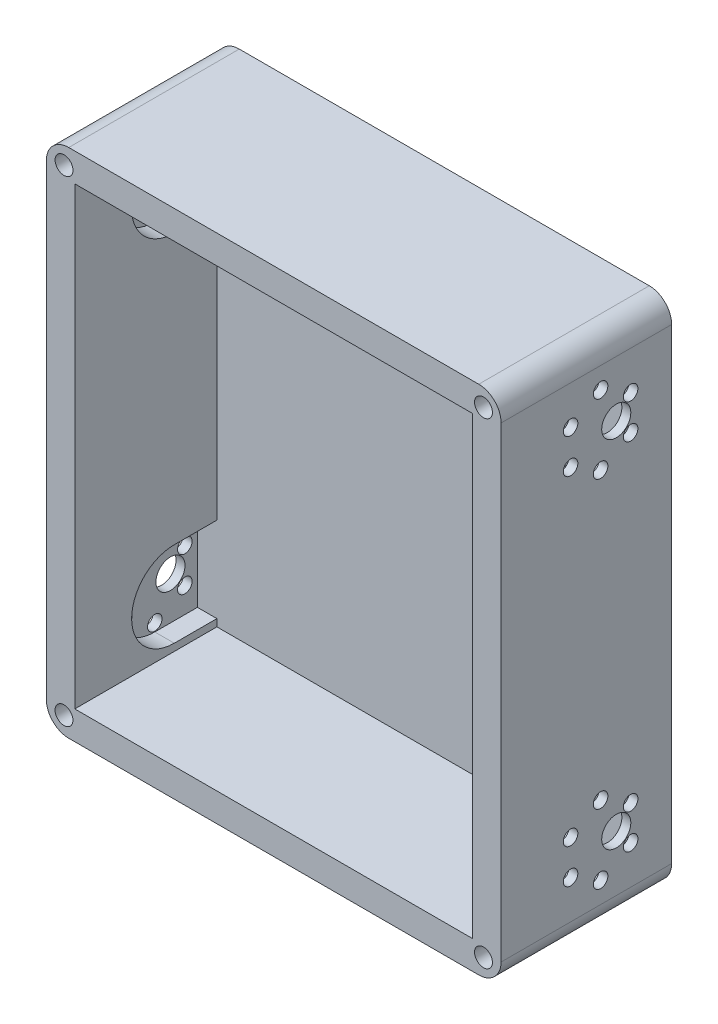
from build123d import *

# Parameters (mm, degrees)
SKETCH1_W                        = 203.2
SKETCH1_H                        = 228.6
CHASSIS_DEPTH                    = 76.2
CHASSIS_COMPARTMENT_T            = -12.7
OUTER_FILLETS_R                  = 10
LEFT_MOTOR_COMPARTMENTS_DEPTH    = 8.7
RIGHT_START                      = -8.7
RIGHT_MOTOR_COMPARTMENTS_DEPTH   = 8.7
SKETCH8_R                        = 3.999993352
SKETCH8_R_2                      = 4
LID_HOLES_DEPTH                  = 10
SCREW_AND_SHAFT_HOLES_DEPTH      = 278.790948922
SCREW_AND_SHAFT_HOLES_DEPTH_BACK = 278.790948922
SKETCH10_R                       = 3.25
SKETCH10_R_2                     = 6.5


with BuildPart() as part:
    # Sketch1 → Chassis (new body)
    with BuildSketch(Plane.XY):
        with Locations((-5.130884808, -63.69081803)):
            Rectangle(SKETCH1_W, SKETCH1_H)
    extrude(amount=CHASSIS_DEPTH)

    # Chassis Compartment
    chassis_compartment_openings = [part.faces().sort_by_distance(p)[0] for p in [
        (-5.130884808, -63.69081803, 76.2),
    ]]
    offset(amount=CHASSIS_COMPARTMENT_T, openings=chassis_compartment_openings, kind=Kind.INTERSECTION)

    # Outer Fillets
    outer_fillets_edges = [part.edges().sort_by_distance(p)[0] for p in [
        (96.469115192, 50.60918197, 38.1),
        (-106.730884808, 50.60918197, 38.1),
        (-106.730884808, -177.99081803, 38.1),
        (96.469115192, -177.99081803, 38.1),
    ]]
    fillet(outer_fillets_edges, radius=OUTER_FILLETS_R)

    # Sketch3 → Left Motor Compartments (cut)
    with BuildSketch(Plane.ZY.offset(94.030884808)):
        with BuildLine():
            Line((31.75, -162.09081803), (12.7, -162.09081803))
            Line((12.7, -162.09081803), (12.7, -123.99081803))
            Line((12.7, -123.99081803), (31.75, -123.99081803))
            ThreePointArc((31.75, -123.99081803), (50.8, -143.04081803), (31.75, -162.09081803))
        make_face()
        with BuildLine():
            Line((31.75, -3.39081803), (12.7, -3.39081803))
            Line((12.7, -3.39081803), (12.7, 34.70918197))
            Line((12.7, 34.70918197), (31.75, 34.70918197))
            ThreePointArc((31.75, 34.70918197), (50.8, 15.65918197), (31.75, -3.39081803))
        make_face()
    extrude(amount=LEFT_MOTOR_COMPARTMENTS_DEPTH, mode=Mode.SUBTRACT)

    # Sketch5 → Right Motor Compartments (cut)
    with BuildSketch(Plane.ZY.offset(-83.769115192).offset(RIGHT_START)):
        with BuildLine():
            Line((31.75, 34.70918197), (12.7, 34.70918197))
            Line((12.7, 34.70918197), (12.7, -3.39081803))
            Line((12.7, -3.39081803), (31.75, -3.39081803))
            ThreePointArc((31.75, -3.39081803), (50.8, 15.65918197), (31.75, 34.70918197))
        make_face()
        with BuildLine():
            Line((31.75, -123.99081803), (12.7, -123.99081803))
            Line((12.7, -123.99081803), (12.7, -162.09081803))
            Line((12.7, -162.09081803), (31.75, -162.09081803))
            ThreePointArc((31.75, -162.09081803), (50.8, -143.04081803), (31.75, -123.99081803))
        make_face()
    extrude(amount=RIGHT_MOTOR_COMPARTMENTS_DEPTH, mode=Mode.SUBTRACT)

    # Sketch8 → Lid Holes (cut)
    with BuildSketch(Plane.XY.offset(76.2)):
        with Locations((88.590435536, -170.112138374)):
            Circle(SKETCH8_R)
        with Locations((-98.852205152, -170.112138374)):
            Circle(SKETCH8_R)
        with Locations((88.590435536, 42.730502314)):
            Circle(SKETCH8_R_2)
        with Locations((-98.836735073, 42.746020894)):
            Circle(SKETCH8_R)
    extrude(amount=-LID_HOLES_DEPTH, mode=Mode.SUBTRACT)

    # Sketch10 → Screw and Shaft Holes (cut, two sides: drawn at the far end of the back side and taken through both)
    with BuildSketch(Plane(origin=(-102.730884808, 0, 0), x_dir=(0, 0, -1), z_dir=(1, 0, 0)).offset(-SCREW_AND_SHAFT_HOLES_DEPTH_BACK)):
        with Locations((-31.75, -127.54081803)):
            Circle(SKETCH10_R)
        with Locations((-45.173393759, -135.29081803)):
            Circle(SKETCH10_R)
        with Locations((-18.326606241, -135.29081803)):
            Circle(SKETCH10_R)
        with Locations((-45.173393759, -150.79081803)):
            Circle(SKETCH10_R)
        with Locations((-18.326606241, -150.79081803)):
            Circle(SKETCH10_R)
        with Locations((-31.75, -158.54081803)):
            Circle(SKETCH10_R)
        with Locations((-31.75, 31.15918197)):
            Circle(SKETCH10_R)
        with Locations((-45.173393759, 23.40918197)):
            Circle(SKETCH10_R)
        with Locations((-18.326606241, 23.40918197)):
            Circle(SKETCH10_R)
        with Locations((-45.173393759, 7.90918197)):
            Circle(SKETCH10_R)
        with Locations((-18.326606241, 7.90918197)):
            Circle(SKETCH10_R)
        with Locations((-31.75, 0.15918197)):
            Circle(SKETCH10_R)
        with Locations((-24.75, -143.04081803)):
            Circle(SKETCH10_R_2)
        with Locations((-24.75, 15.65918197)):
            Circle(SKETCH10_R_2)
    extrude(amount=SCREW_AND_SHAFT_HOLES_DEPTH + SCREW_AND_SHAFT_HOLES_DEPTH_BACK, mode=Mode.SUBTRACT)


solid = part.part
